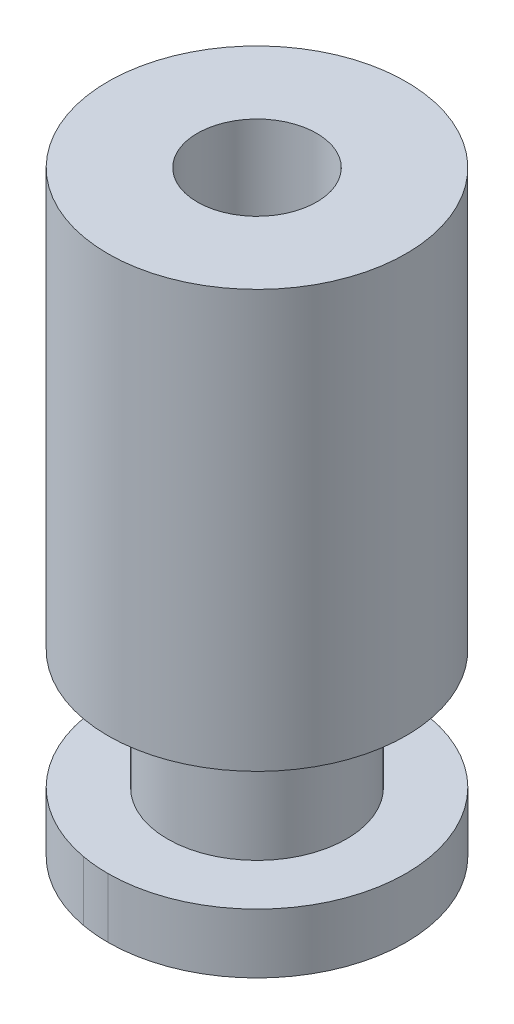
from build123d import *

# Parameters (mm, degrees)
SKETCH1_R           = 12.5
BOSS_EXTRUDE1_DEPTH = 50
SKETCH2_R           = 5
CUT_EXTRUDE1_DEPTH  = 20
SKETCH3_W           = 5
SKETCH3_H           = 10


with BuildPart() as part:
    # Sketch1 → Boss-Extrude1 (new body)
    with BuildSketch(Plane(origin=(0, 0, 0), x_dir=(1, 0, 0), z_dir=(0, 1, 0))):
        with Locations(Location((0, 0, 0), (0, 0, 270))):
            Circle(SKETCH1_R)
    extrude(amount=BOSS_EXTRUDE1_DEPTH)

    # Sketch2 → Cut-Extrude1 (cut)
    with BuildSketch(Plane(origin=(0, 50, 0), x_dir=(1, 0, 0), z_dir=(0, 1, 0))):
        with Locations(Location((0, 0, 0), (0, 0, 270))):
            Circle(SKETCH2_R)
    extrude(amount=-CUT_EXTRUDE1_DEPTH, mode=Mode.SUBTRACT)

    # Sketch3 → Cut-Revolve1 (revolve, cut)
    with BuildSketch(Plane(origin=(0, 0, 0), x_dir=(0, 0, -1), z_dir=(1, 0, 0)), mode=Mode.PRIVATE) as cut_revolve1_sk:
        with Locations((10, 10)):
            Rectangle(SKETCH3_W, SKETCH3_H)
    revolve(cut_revolve1_sk.sketch.rotate(Axis((0, 58.266357572, 0), (0, -1, 0)), 180), axis=Axis((0, 58.266357572, 0), (0, -1, 0)), mode=Mode.SUBTRACT)


solid = part.part
